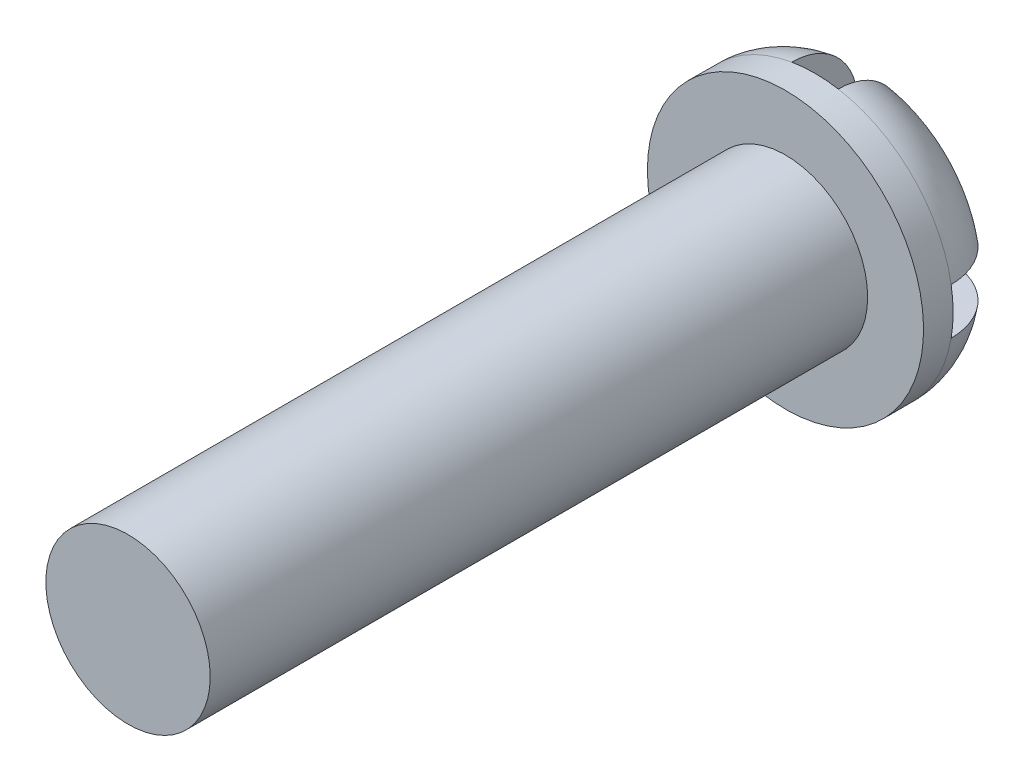
from build123d import *

# Parameters (mm, degrees)
SKETCH_1_R          = 2.5
EXTRUDE_1_DEPTH     = 20
SKETCH_2_R          = 4.2
EXTRUDE_2_DEPTH     = 2.9
FILLET_1_R          = 2
CUT_EXTRUDE_1_DEPTH = 2


with BuildPart() as part:
    # 草图1 → 凸台-拉伸1 (new body)
    with BuildSketch(Plane.XY):
        Circle(SKETCH_1_R)
    extrude(amount=EXTRUDE_1_DEPTH)

    # 草图2 → 凸台-拉伸2 (add)
    with BuildSketch(Plane(origin=(0, 0, 0), x_dir=(-1, 0, 0), z_dir=(0, 0, -1))):
        Circle(SKETCH_2_R)
    extrude(amount=EXTRUDE_2_DEPTH)

    # 圆角1
    fillet_1_edges = [part.edges().sort_by_distance(p)[0] for p in [
        (4.2, 0, -2.9),
    ]]
    fillet(fillet_1_edges, radius=FILLET_1_R)

    # 草图3 → 切除-拉伸1 (cut)
    with BuildSketch(Plane(origin=(0, 0, -2.9), x_dir=(-1, 0, 0), z_dir=(0, 0, -1))):
        Polygon((-0.707106781, 0.707106781), (-0.707106781, 6.006401657), (0.707106781, 6.006401657), (0.707106781, 0.707106781), (6.006401657, 0.707106781), (6.006401657, -0.707106781), (0.707106781, -0.707106781), (0.707106781, -6.006401657), (-0.707106781, -6.006401657), (-0.707106781, -0.707106781), (-6.006401657, -0.707106781), (-6.006401657, 0.707106781), align=None)
    extrude(amount=-CUT_EXTRUDE_1_DEPTH, mode=Mode.SUBTRACT)


solid = part.part
